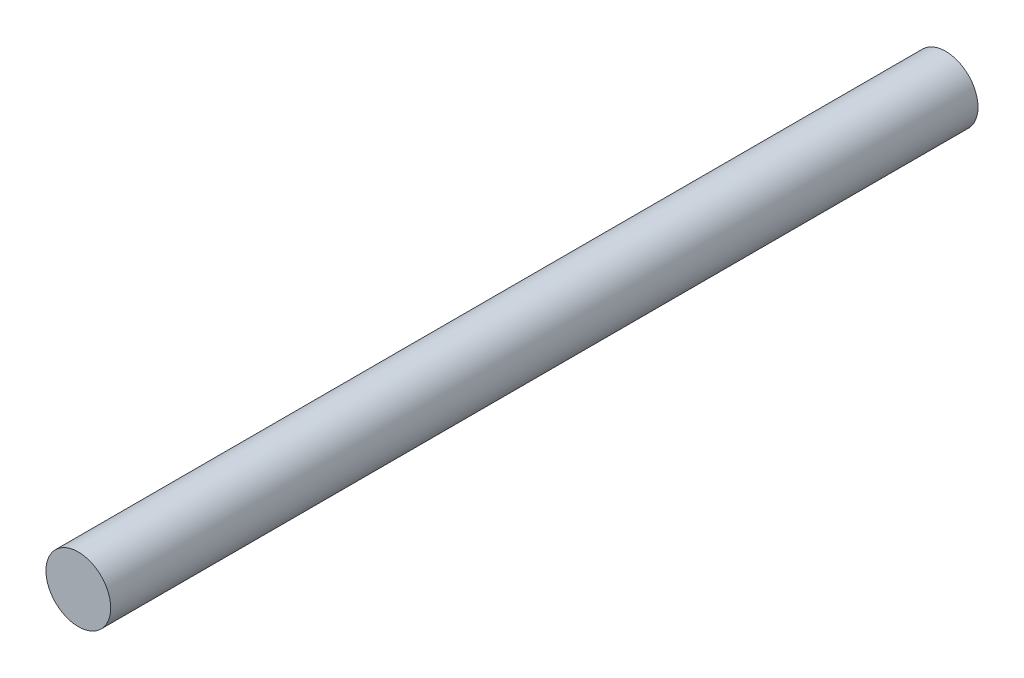
from build123d import *

# Parameters (mm, degrees)
ESTRUSIONE_ESTRUSIONE1_DEPTH      = 375
ESTRUSIONE_ESTRUSIONE1_DEPTH_BACK = 375
SCHIZZO1_R                        = 28


with BuildPart() as part:
    # Schizzo1 → Estrusione-Estrusione1 (new, two sides: drawn at the far end of the back side and taken through both)
    with BuildSketch(Plane.XY.offset(-ESTRUSIONE_ESTRUSIONE1_DEPTH_BACK)):
        Circle(SCHIZZO1_R)
    extrude(amount=ESTRUSIONE_ESTRUSIONE1_DEPTH + ESTRUSIONE_ESTRUSIONE1_DEPTH_BACK)


solid = part.part
